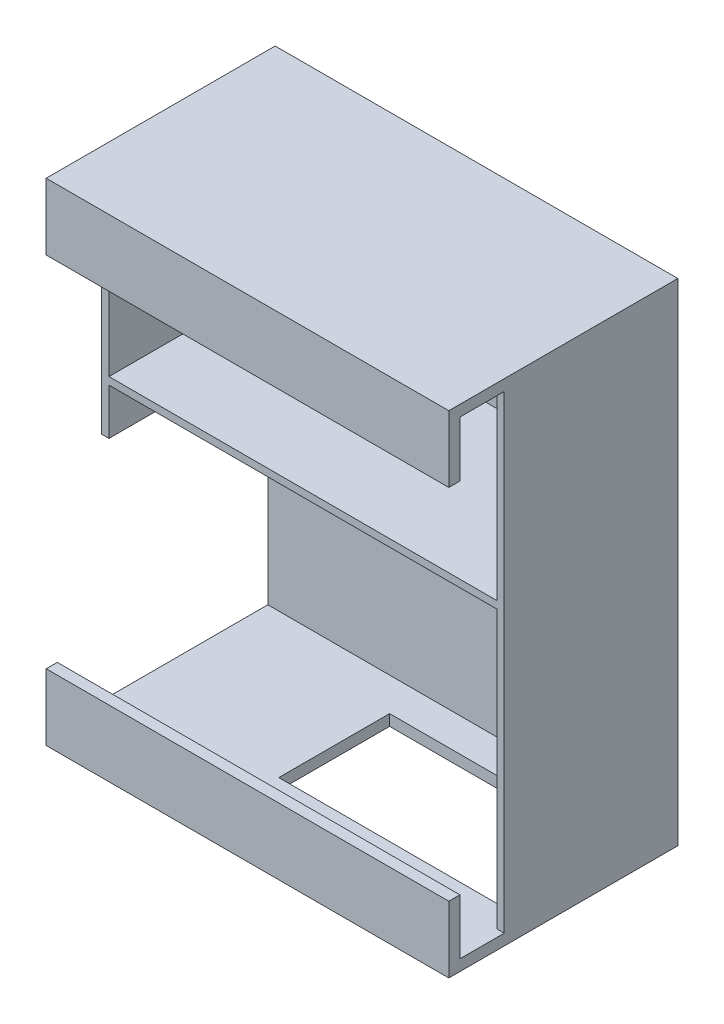
from build123d import *

# Parameters (mm, degrees)
SKETCH1_W           = 109
SKETCH1_H           = 133
BOSS_EXTRUDE1_DEPTH = 62
SKETCH3_W           = 3
SKETCH3_H           = 77
CUT_EXTRUDE2_DEPTH  = 109
SKETCH4_W           = 12
SKETCH4_H           = 127
CUT_EXTRUDE3_DEPTH  = 109
SKETCH5_W           = 45
SKETCH5_H           = 65
CUT_EXTRUDE4_DEPTH  = 107
SKETCH6_W           = 105
SKETCH6_H           = 10
CUT_EXTRUDE5_DEPTH  = 45
SKETCH7_W           = 105
SKETCH7_H           = 50
CUT_EXTRUDE6_DEPTH  = 45
SKETCH9_W           = 105
SKETCH9_H           = 32
CUT_EXTRUDE7_DEPTH  = 45
SKETCH11_W          = 3
SKETCH11_H          = 10
CUT_EXTRUDE9_DEPTH  = 192
SKETCH10_W          = 65
SKETCH10_H          = 30
CUT_EXTRUDE10_DEPTH = 10
SKETCH14_W          = 2
SKETCH14_H          = 45
BOSS_EXTRUDE2_DEPTH = 2.5


with BuildPart() as part:
    # Sketch1 → Boss-Extrude1 (new body)
    with BuildSketch(Plane.XY):
        Rectangle(SKETCH1_W, SKETCH1_H)
    extrude(amount=BOSS_EXTRUDE1_DEPTH)

    # Sketch3 → Cut-Extrude2 (cut)
    with BuildSketch(Plane.ZY.offset(54.5)):
        with Locations((60.5, 0)):
            Rectangle(SKETCH3_W, SKETCH3_H)
    extrude(amount=-CUT_EXTRUDE2_DEPTH, mode=Mode.SUBTRACT)

    # Sketch4 → Cut-Extrude3 (cut)
    with BuildSketch(Plane.ZY.offset(54.5)):
        with Locations((53, 0)):
            Rectangle(SKETCH4_W, SKETCH4_H)
    extrude(amount=-CUT_EXTRUDE3_DEPTH, mode=Mode.SUBTRACT)

    # Sketch5 → Cut-Extrude4 (cut)
    with BuildSketch(Plane.ZY.offset(54.5)):
        with Locations((24.5, -31)):
            Rectangle(SKETCH5_W, SKETCH5_H)
    extrude(amount=-CUT_EXTRUDE4_DEPTH, mode=Mode.SUBTRACT)

    # Sketch6 → Cut-Extrude5 (cut)
    with BuildSketch(Plane.XY.offset(47)):
        with Locations((0, 6.5)):
            Rectangle(SKETCH6_W, SKETCH6_H)
    extrude(amount=-CUT_EXTRUDE5_DEPTH, mode=Mode.SUBTRACT)

    # Sketch7 → Cut-Extrude6 (cut)
    with BuildSketch(Plane.XY.offset(47)):
        with Locations((0, 38.5)):
            Rectangle(SKETCH7_W, SKETCH7_H)
    extrude(amount=-CUT_EXTRUDE6_DEPTH, mode=Mode.SUBTRACT)

    # Sketch9 → Cut-Extrude7 (cut)
    with BuildSketch(Plane(origin=(0, 0, 0), x_dir=(-1, 0, 0), z_dir=(0, 0, -1))):
        with Locations((0, 38.5)):
            Rectangle(SKETCH9_W, SKETCH9_H)
    extrude(amount=-CUT_EXTRUDE7_DEPTH, mode=Mode.SUBTRACT)

    # Sketch11 → Cut-Extrude9 (cut)
    with BuildSketch(Plane.ZY.offset(54.5)):
        with Locations((60.5, 43.5)):
            Rectangle(SKETCH11_W, SKETCH11_H)
        with Locations((60.5, -43.5)):
            Rectangle(SKETCH11_W, SKETCH11_H)
    extrude(amount=-CUT_EXTRUDE9_DEPTH, mode=Mode.SUBTRACT)

    # Sketch10 → Cut-Extrude10 (cut)
    with BuildSketch(Plane.XZ.offset(66.5)):
        with Locations((20, 26.022609269)):
            Rectangle(SKETCH10_W, SKETCH10_H)
    extrude(amount=-CUT_EXTRUDE10_DEPTH, mode=Mode.SUBTRACT)

    # Sketch14 → Boss-Extrude2 (add)
    with BuildSketch(Plane.XZ.offset(-1.5)):
        with Locations((-53.5, 24.5)):
            Rectangle(SKETCH14_W, SKETCH14_H)
    extrude(amount=BOSS_EXTRUDE2_DEPTH)


solid = part.part
